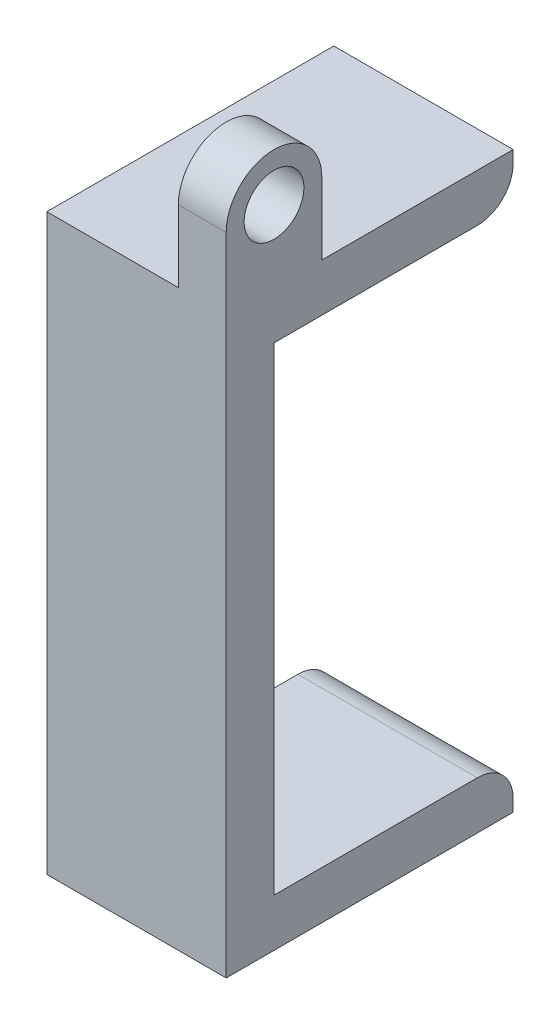
from build123d import *

# Parameters (mm, degrees)
SKETCH2_R           = 4
SKETCH2_R_2         = 2.5
BOSS_EXTRUDE1_DEPTH = 4
SKETCH3_W           = 24
SKETCH3_H           = 48
BOSS_EXTRUDE2_DEPTH = 15
SKETCH4_W           = 20
SKETCH4_H           = 40
CUT_EXTRUDE1_DEPTH  = 15
FILLET1_R           = 3


with BuildPart() as part:
    # Sketch2 → Boss-Extrude1 (new body)
    # profile 1 of 2: a face of its own
    with BuildSketch(Plane(origin=(0, 0, 0), x_dir=(0, 0, -1), z_dir=(1, 0, 0))):
        with Locations((0, 1)):
            Circle(SKETCH2_R)
        with Locations((0, 1)):
            Circle(SKETCH2_R_2, mode=Mode.SUBTRACT)
    # profile 2 of 2: a face of its own
    with BuildSketch(Plane(origin=(0, 0, 0), x_dir=(0, 0, -1), z_dir=(1, 0, 0))):
        with BuildLine():
            Line((-4, 1), (-4, -5))
            Line((-4, -5), (4, -5))
            Line((4, -5), (4, 1))
            ThreePointArc((4, 1), (0, -3), (-4, 1))
        make_face()
    extrude(amount=BOSS_EXTRUDE1_DEPTH)

    # Sketch3 → Boss-Extrude2 (add)
    with BuildSketch(Plane(origin=(4, 0, 0), x_dir=(0, 0, -1), z_dir=(1, 0, 0))):
        with Locations((8, -29)):
            Rectangle(SKETCH3_W, SKETCH3_H)
    extrude(amount=-BOSS_EXTRUDE2_DEPTH)

    # Sketch4 → Cut-Extrude1 (cut)
    with BuildSketch(Plane.ZY.offset(11)):
        with Locations((-10, -29)):
            Rectangle(SKETCH4_W, SKETCH4_H)
    extrude(amount=-CUT_EXTRUDE1_DEPTH, mode=Mode.SUBTRACT)

    # Fillet1
    fillet1_edges = [part.edges().sort_by_distance(p)[0] for p in [
        (-3.5, -9, -20),
        (-3.5, -49, -20),
    ]]
    fillet(fillet1_edges, radius=FILLET1_R)


solid = part.part
